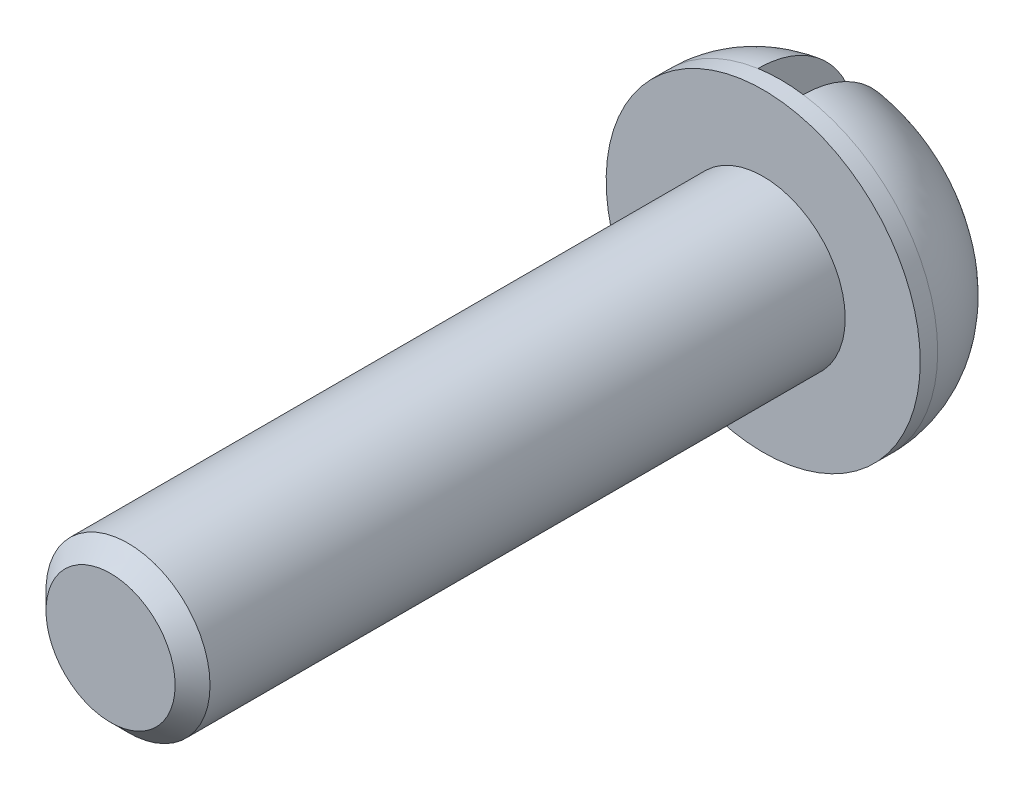
from build123d import *

# Parameters (mm, degrees)
ESBO_O1_R                = 4.5
RESSALTO_EXTRUS_O1_DEPTH = 3.3
ESBO_O2_R                = 2.35
RESSALTO_EXTRUS_O2_DEPTH = 22
FILETE1_R                = 2.8
ESBO_O3_W                = 1.3
ESBO_O3_H                = 10.03421546
CORTE_EXTRUS_O1_DEPTH    = 2.8
CHANFRO1_SIZE            = 0.5


with BuildPart() as part:
    # Esboço1 → Ressalto-extrusão1 (new body)
    with BuildSketch(Plane.XY):
        Circle(ESBO_O1_R)
    extrude(amount=RESSALTO_EXTRUS_O1_DEPTH)

    # Esboço2 → Ressalto-extrusão2 (add)
    with BuildSketch(Plane.XY):
        Circle(ESBO_O2_R)
    extrude(amount=RESSALTO_EXTRUS_O2_DEPTH)

    # Filete1
    filete1_edges = [part.edges().sort_by_distance(p)[0] for p in [
        (-4.5, 0, 0),
    ]]
    fillet(filete1_edges, radius=FILETE1_R)

    # Esboço3 → Corte-extrusão1 (cut)
    with BuildSketch(Plane(origin=(0, 0, 0), x_dir=(-1, 0, 0), z_dir=(0, 0, -1))):
        Rectangle(ESBO_O3_W, ESBO_O3_H)
    extrude(amount=-CORTE_EXTRUS_O1_DEPTH, mode=Mode.SUBTRACT)

    # Chanfro1
    chanfro1_edges = [part.edges().sort_by_distance(p)[0] for p in [
        (-2.35, 0, 22),
    ]]
    chamfer(chanfro1_edges, length=CHANFRO1_SIZE)


solid = part.part
